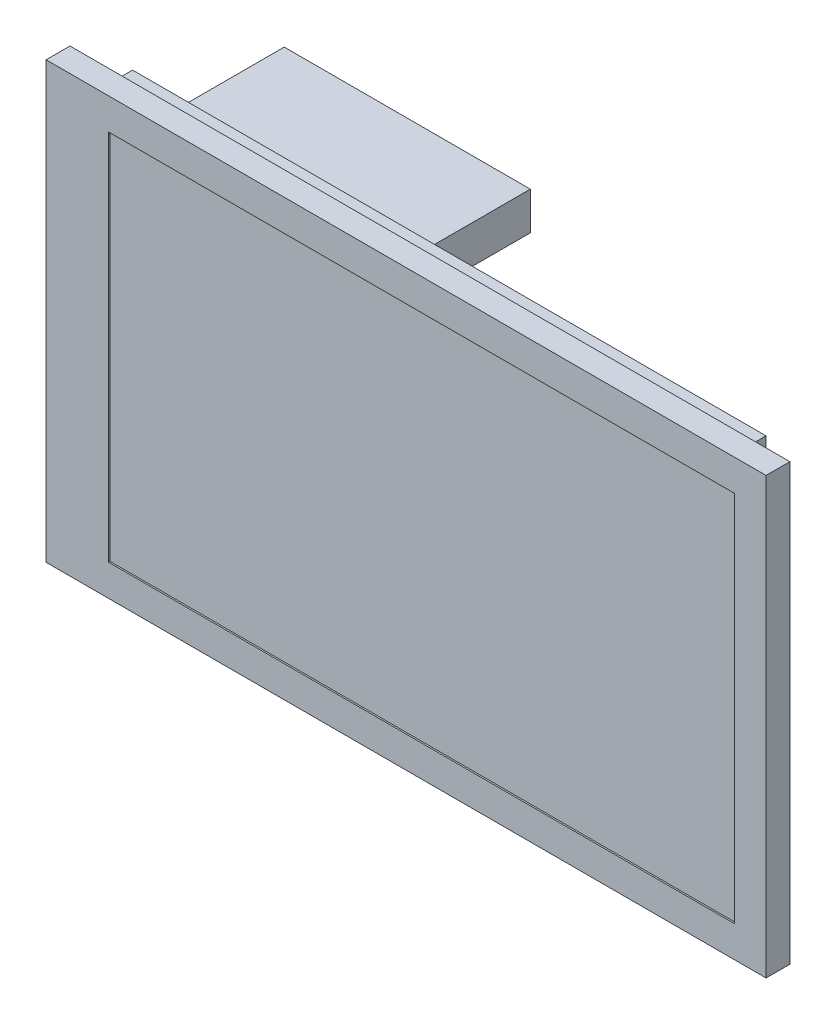
from build123d import *

# Parameters (mm, degrees)
SKETCH1_W                = 84
SKETCH1_H                = 50
BOSS_EXTRUDE1_DEPTH      = 3
BOSS_EXTRUDE2_DEPTH      = 0.2
BOSS_EXTRUDE2_DEPTH_BACK = 3
SKETCH2_W                = 96.6
SKETCH2_H                = 58.4
SKETCH2_W_2              = 84
SKETCH2_H_2              = 50
SKETCH4_W                = 84.6
SKETCH4_H                = 46.4
BOSS_EXTRUDE4_DEPTH      = 1
SKETCH5_W                = 85
SKETCH5_H                = 56
BOSS_EXTRUDE5_DEPTH      = 1.6
SKETCH6_W                = 2.54
SKETCH6_H                = 2.54
SKETCH6_W_2              = 1.3
SKETCH6_H_2              = 1.3
BOSS_EXTRUDE6_DEPTH      = 13.65
LPATTERN1_COUNT          = 13
LPATTERN1_PITCH          = 2.54
LPATTERN1_COUNT_DIR2     = 2
LPATTERN1_PITCH_DIR2     = 2.54
SKETCH7_W                = 10.2
SKETCH7_H                = 4.7
SKETCH7_W_2              = 5.3
SKETCH7_H_2              = 5.6
SKETCH7_W_3              = 3.5
SKETCH7_H_3              = 1.7
SKETCH7_W_4              = 3.7
SKETCH7_H_4              = 6.2
BOSS_EXTRUDE7_DEPTH      = 1.7
SKETCH8_W                = 0.528571429
SKETCH8_H                = 0.384415585
SKETCH8_H_2              = 0.384415584
SKETCH8_W_2              = 2.690909091
BOSS_EXTRUDE8_DEPTH      = 0.1


with BuildPart() as part:
    # Sketch1 → Boss-Extrude1 (new body)
    with BuildSketch(Plane.XY):
        Rectangle(SKETCH1_W, SKETCH1_H)
    extrude(amount=-BOSS_EXTRUDE1_DEPTH)

    # Sketch2 → Boss-Extrude2 (add, two sides: drawn at the far end of the back side and taken through both)
    with BuildSketch(Plane.XY.offset(-BOSS_EXTRUDE2_DEPTH_BACK)):
        with Locations((-2.1, 0)):
            Rectangle(SKETCH2_W, SKETCH2_H)
        Rectangle(SKETCH2_W_2, SKETCH2_H_2, mode=Mode.SUBTRACT)
    extrude(amount=BOSS_EXTRUDE2_DEPTH + BOSS_EXTRUDE2_DEPTH_BACK)

    # Sketch4 → Boss-Extrude4 (add)
    with BuildSketch(Plane(origin=(0, 0, -3), x_dir=(-1, 0, 0), z_dir=(0, 0, -1))):
        with Locations((2.1, 0)):
            Rectangle(SKETCH4_W, SKETCH4_H)
    extrude(amount=BOSS_EXTRUDE4_DEPTH)

    # Sketch5 → Boss-Extrude5 (add)
    with BuildSketch(Plane(origin=(0, 0, -4), x_dir=(-1, 0, 0), z_dir=(0, 0, -1))):
        with Locations((2.1, 0)):
            Rectangle(SKETCH5_W, SKETCH5_H)
    extrude(amount=BOSS_EXTRUDE5_DEPTH)

    # Sketch6 → Boss-Extrude6 (add)
    with BuildSketch(Plane(origin=(0, 0, -5.6), x_dir=(-1, 0, 0), z_dir=(0, 0, -1))):
        with Locations((36.63, 25.93)):
            Rectangle(SKETCH6_W, SKETCH6_H)
        with Locations((36.63, 25.93)):
            Rectangle(SKETCH6_W_2, SKETCH6_H_2, mode=Mode.SUBTRACT)
    boss_extrude6 = extrude(amount=BOSS_EXTRUDE6_DEPTH)

    # LPattern1: Boss-Extrude6 13 × 2
    with Locations(*[(i * LPATTERN1_PITCH, -j * LPATTERN1_PITCH_DIR2, 0) for i in range(LPATTERN1_COUNT) for j in range(LPATTERN1_COUNT_DIR2) if (i, j) != (0, 0)]):
        add(boss_extrude6)

    # Sketch7 → Boss-Extrude7 (add)
    with BuildSketch(Plane(origin=(0, 0, -5.6), x_dir=(-1, 0, 0), z_dir=(0, 0, -1))):
        with Locations((8.1, -10.35)):
            Rectangle(SKETCH7_W, SKETCH7_H)
        with Locations((8.1, -0.55)):
            Rectangle(SKETCH7_W, SKETCH7_H)
        with Locations((8.1, 12.65)):
            Rectangle(SKETCH7_W, SKETCH7_H)
        with Locations((-4.3, 12.65)):
            Rectangle(SKETCH7_W, SKETCH7_H)
        with Locations((26.95, 0.7)):
            Rectangle(SKETCH7_W_2, SKETCH7_H_2)
        with Locations((36.35, 6.15)):
            Rectangle(SKETCH7_W_3, SKETCH7_H_3)
        with Locations((36.45, 1.1)):
            Rectangle(SKETCH7_W_4, SKETCH7_H_4)
        with Locations((36.35, -4.35)):
            Rectangle(SKETCH7_W_3, SKETCH7_H_3)
    extrude(amount=BOSS_EXTRUDE7_DEPTH)

    # Sketch8 → Boss-Extrude8 (add)
    # profile 1 of 18: a face of its own
    with BuildSketch(Plane(origin=(0, 0, -5.6), x_dir=(-1, 0, 0), z_dir=(0, 0, -1))):
        with BuildLine():
            Line((-33.709090909, -24.401219239), (-33.757142857, -24.016803654))
            add(Edge.make_bspline(
                [(-33.757142857, -24.016803654), (-33.72805265, -24.011845745), (-33.671366483, -24.002184595), (-33.589792673, -23.983175734), (-33.51346079, -23.962429355), (-33.44308942, -23.938383841), (-33.377991194, -23.91217353), (-33.318581194, -23.883108061), (-33.264869364, -23.850611793), (-33.216824573, -23.815484607), (-33.174219303, -23.777618003), (-33.137332634, -23.737184237), (-33.106190952, -23.693804629), (-33.080274432, -23.647892699), (-33.061048466, -23.598721901), (-33.04637523, -23.547258356), (-33.038214219, -23.4927459), (-33.03698946, -23.455472208), (-33.036363636, -23.436426219)],
                knots=[0, 0, 0, 0, 1.392235382, 2.712957193, 3.95076201, 5.123471921, 6.220028287, 7.260520794, 8.240826993, 9.178593426, 10.065213643, 10.926376853, 11.755607984, 12.580369742, 13.407158359, 14.241002189, 15.101193065, 16, 16, 16, 16], degree=3))
            add(Edge.make_bspline(
                [(-33.036363636, -23.436426219), (-33.036759999, -23.415594785), (-33.037539057, -23.374650247), (-33.049145033, -23.314648819), (-33.06498982, -23.256354123), (-33.089668669, -23.200771333), (-33.119992727, -23.146921758), (-33.156578054, -23.094737727), (-33.201806698, -23.046270859), (-33.251523641, -22.999070538), (-33.306721122, -22.955548008), (-33.366993183, -22.917980414), (-33.431320052, -22.886597619), (-33.499064455, -22.859559114), (-33.571679862, -22.841042414), (-33.647435373, -22.825219515), (-33.727699215, -22.817413688), (-33.782407808, -22.816151783), (-33.810450487, -22.815504953)],
                knots=[0, 0, 0, 0, 0.90401877, 1.776864238, 2.648081008, 3.525187418, 4.41175602, 5.332444618, 6.287459433, 7.287987893, 8.31086095, 9.337199425, 10.368656826, 11.419214808, 12.501240718, 13.621372252, 14.780756564, 16, 16, 16, 16], degree=3))
            add(Edge.make_bspline(
                [(-33.810450487, -22.815504953), (-33.83674454, -22.816185809), (-33.88793822, -22.817511415), (-33.962820531, -22.824802446), (-34.033764203, -22.838161351), (-34.100575379, -22.858121567), (-34.164283462, -22.881758082), (-34.223586775, -22.911928591), (-34.278828269, -22.947530169), (-34.329602926, -22.987812879), (-34.375399178, -23.03226819), (-34.416031533, -23.079218976), (-34.450189652, -23.129025747), (-34.477354958, -23.181677852), (-34.499230924, -23.236433178), (-34.515191196, -23.293771003), (-34.524299668, -23.353792737), (-34.525408672, -23.394600357), (-34.525974026, -23.415403492)],
                knots=[0, 0, 0, 0, 1.208597586, 2.353100882, 3.45394355, 4.52041929, 5.55433039, 6.572835576, 7.571467818, 8.570232532, 9.546354476, 10.500752408, 11.419554319, 12.314725937, 13.218209175, 14.125127028, 15.044216874, 16, 16, 16, 16], degree=3))
            add(Edge.make_bspline(
                [(-34.525974026, -23.415403492), (-34.52538209, -23.43421221), (-34.524120244, -23.474307222), (-34.513207698, -23.537442526), (-34.497870236, -23.607313608), (-34.482819757, -23.655266555), (-34.474918831, -23.680440018)],
                knots=[0, 0, 0, 0, 0.832645691, 1.774971563, 2.831945141, 4, 4, 4, 4], degree=3))
            Line((-34.474918831, -23.680440018), (-34.91038961, -23.63238807))
            Line((-34.91038961, -23.63238807), (-34.905133929, -23.57457557))
            add(Edge.make_bspline(
                [(-34.905133929, -23.57457557), (-34.905389127, -23.552266942), (-34.905887105, -23.508735268), (-34.914980269, -23.445052273), (-34.927178755, -23.384368767), (-34.945160313, -23.326904528), (-34.969133857, -23.273255413), (-34.996255312, -23.221673826), (-35.030830796, -23.174607452), (-35.068634756, -23.13000737), (-35.111751787, -23.090663828), (-35.157304231, -23.054672672), (-35.207380206, -23.025663158), (-35.260533703, -23.001048649), (-35.317363124, -22.982837619), (-35.377308583, -22.968808647), (-35.440794476, -22.961712637), (-35.484245896, -22.960356448), (-35.506534091, -22.959660797)],
                knots=[0, 0, 0, 0, 1.104751502, 2.155743671, 3.182513959, 4.171256571, 5.132373004, 6.092768569, 7.053244257, 8.020744794, 8.986334532, 9.941668794, 10.892724274, 11.847575109, 12.840124028, 13.845307576, 14.89476101, 16, 16, 16, 16], degree=3))
            add(Edge.make_bspline(
                [(-35.506534091, -22.959660797), (-35.546468143, -22.961371554), (-35.623214248, -22.964659323), (-35.732652217, -22.990290916), (-35.829854701, -23.034168014), (-35.912619476, -23.095435068), (-35.979485312, -23.168511938), (-36.028391335, -23.250949201), (-36.058188146, -23.34158199), (-36.061797949, -23.40492), (-36.063636364, -23.437177031)],
                knots=[0, 0, 0, 0, 1.16832052, 2.245303051, 3.268291818, 4.269210926, 5.239185917, 6.148985104, 7.05730787, 8, 8, 8, 8], degree=3))
            add(Edge.make_bspline(
                [(-36.063636364, -23.437177031), (-36.062074934, -23.470681699), (-36.059037413, -23.535859893), (-36.03017405, -23.629106377), (-35.985773103, -23.714570317), (-35.933243599, -23.777451186), (-35.882808638, -23.821875076), (-35.839717993, -23.852650786), (-35.792409841, -23.880704007), (-35.73993312, -23.90419119), (-35.683769052, -23.926859716), (-35.621941335, -23.942876542), (-35.556351546, -23.958880175), (-35.51061513, -23.965391537), (-35.487012987, -23.968751706)],
                knots=[0, 0, 0, 0, 1.388978158, 2.702043981, 4.01873002, 5.370445164, 6.077879322, 6.808188353, 7.568116439, 8.359222831, 9.195597867, 10.081410868, 11.009917745, 12, 12, 12, 12], degree=3))
            Line((-35.487012987, -23.968751706), (-35.535064935, -24.353167291))
            add(Edge.make_bspline(
                [(-35.535064935, -24.353167291), (-35.571697972, -24.346872738), (-35.643158088, -24.334593947), (-35.745985257, -24.30894068), (-35.842047071, -24.278409893), (-35.930814562, -24.241444431), (-36.013058354, -24.199471816), (-36.088431365, -24.151983703), (-36.157428445, -24.099598625), (-36.218143885, -24.040496654), (-36.27222007, -23.977681211), (-36.318921262, -23.911115814), (-36.359118515, -23.841987277), (-36.391502117, -23.769156198), (-36.417180802, -23.69330645), (-36.435150549, -23.614058254), (-36.445773653, -23.531818803), (-36.447285252, -23.476000117), (-36.448051948, -23.447688394)],
                knots=[0, 0, 0, 0, 1.259750421, 2.457396855, 3.589696629, 4.673763457, 5.713494597, 6.716289503, 7.690389722, 8.644478697, 9.583164327, 10.496506905, 11.397350125, 12.289843847, 13.194037124, 14.107891875, 15.040306322, 16, 16, 16, 16], degree=3))
            add(Edge.make_bspline(
                [(-36.448051948, -23.447688394), (-36.447173676, -23.417856142), (-36.445445809, -23.359165736), (-36.432138518, -23.272918699), (-36.411523743, -23.189912141), (-36.381049885, -23.110760183), (-36.342532889, -23.034860215), (-36.294735039, -22.962711808), (-36.239073258, -22.893464082), (-36.175572177, -22.828463974), (-36.105313345, -22.769491941), (-36.029874393, -22.717518049), (-35.950287212, -22.672671219), (-35.865349964, -22.637609175), (-35.776405977, -22.609703357), (-35.683213519, -22.589499218), (-35.585455626, -22.577093922), (-35.518834964, -22.575870801), (-35.484760552, -22.575245213)],
                knots=[0, 0, 0, 0, 0.987388499, 1.942536239, 2.883158237, 3.814277833, 4.744511983, 5.696058098, 6.674468722, 7.682403848, 8.699933891, 9.706744222, 10.712052869, 11.718590333, 12.743383256, 13.79503062, 14.872226231, 16, 16, 16, 16], degree=3))
            add(Edge.make_bspline(
                [(-35.484760552, -22.575245213), (-35.443617466, -22.57640178), (-35.363265624, -22.578660538), (-35.246708501, -22.600432601), (-35.137357998, -22.634984802), (-35.035941462, -22.683176598), (-34.942979926, -22.743229189), (-34.860750059, -22.815359853), (-34.787862119, -22.897680072), (-34.749570843, -22.960272743), (-34.730194805, -22.9919457)],
                knots=[0, 0, 0, 0, 1.090109576, 2.128968013, 3.132278696, 4.123864162, 5.09769889, 6.057339906, 7.016980922, 8, 8, 8, 8], degree=3))
            add(Edge.make_bspline(
                [(-34.730194805, -22.9919457), (-34.721242985, -22.962852021), (-34.703752266, -22.906006665), (-34.664364047, -22.827584208), (-34.618622091, -22.756076299), (-34.56375654, -22.69218268), (-34.499748822, -22.6353556), (-34.426154491, -22.584612702), (-34.342270179, -22.541015349), (-34.250186626, -22.501627356), (-34.149969411, -22.47076018), (-34.043622195, -22.447045156), (-33.931177043, -22.433597248), (-33.854282585, -22.431937988), (-33.814955357, -22.431089369)],
                knots=[0, 0, 0, 0, 0.945190562, 1.846782401, 2.71900073, 3.580139159, 4.456653473, 5.37426406, 6.352713278, 7.392141409, 8.485180558, 9.608884637, 10.777077804, 12, 12, 12, 12], degree=3))
            add(Edge.make_bspline(
                [(-33.814955357, -22.431089369), (-33.773114973, -22.431834475), (-33.691429591, -22.433289153), (-33.571909415, -22.448168852), (-33.458142952, -22.471337505), (-33.349727003, -22.503117297), (-33.24768961, -22.545899123), (-33.150983091, -22.596751434), (-33.060656885, -22.658042225), (-32.976907169, -22.727702576), (-32.901228277, -22.803525995), (-32.833967865, -22.883369618), (-32.778874842, -22.968198019), (-32.731175696, -23.05516763), (-32.696165512, -23.147054318), (-32.670289121, -23.24204549), (-32.655079715, -23.341085707), (-32.653001381, -23.408344818), (-32.651948052, -23.442432713)],
                knots=[0, 0, 0, 0, 1.16811134, 2.280514916, 3.358044357, 4.408548324, 5.43018962, 6.443354211, 7.455384821, 8.473000684, 9.481330986, 10.444351977, 11.382702375, 12.302115503, 13.209492159, 14.121756026, 15.048078649, 16, 16, 16, 16], degree=3))
            add(Edge.make_bspline(
                [(-32.651948052, -23.442432713), (-32.65278928, -23.474014527), (-32.654446319, -23.536223946), (-32.66829631, -23.627607931), (-32.691048867, -23.715018976), (-32.721581309, -23.79923115), (-32.762884655, -23.879188949), (-32.812301875, -23.955742921), (-32.870988171, -24.028626606), (-32.937990742, -24.097174862), (-33.013039861, -24.1597859), (-33.093919003, -24.216704946), (-33.180964083, -24.266410952), (-33.275047043, -24.307663151), (-33.374834515, -24.341923846), (-33.480628851, -24.369978799), (-33.59261456, -24.390345858), (-33.669726101, -24.397544428), (-33.709090909, -24.401219239)],
                knots=[0, 0, 0, 0, 0.959215385, 1.889449177, 2.800558469, 3.700364268, 4.604976927, 5.528817283, 6.464628809, 7.443299003, 8.436397546, 9.430019983, 10.444889234, 11.476401659, 12.54654308, 13.647683262, 14.799161616, 16, 16, 16, 16], degree=3))
        make_face()
    # profile 2 of 18: a face of its own
    with BuildSketch(Plane(origin=(0, 0, -5.6), x_dir=(-1, 0, 0), z_dir=(0, 0, -1))):
        with Locations((-32.964285715, -21.6622582)):
            Rectangle(SKETCH8_W, SKETCH8_H)
    # profile 3 of 18: a face of its own
    with BuildSketch(Plane(origin=(0, 0, -5.6), x_dir=(-1, 0, 0), z_dir=(0, 0, -1))):
        with BuildLine():
            Line((-33.709090909, -20.845375083), (-33.757142857, -20.460959498))
            add(Edge.make_bspline(
                [(-33.757142857, -20.460959498), (-33.727801933, -20.457056848), (-33.670621561, -20.44945126), (-33.588302096, -20.432529035), (-33.511187899, -20.413811095), (-33.440920724, -20.389086983), (-33.375328546, -20.363412174), (-33.316364664, -20.332348308), (-33.262356892, -20.298850794), (-33.215239632, -20.260803413), (-33.172755898, -20.221350589), (-33.137031227, -20.178980534), (-33.10551633, -20.135927018), (-33.079965836, -20.090888865), (-33.060159869, -20.044039987), (-33.046807911, -19.995535552), (-33.038198069, -19.945706224), (-33.036978747, -19.911901138), (-33.036363636, -19.894847485)],
                knots=[0, 0, 0, 0, 1.411589299, 2.750942728, 4.00771248, 5.193274551, 6.301848483, 7.364530321, 8.36815806, 9.328452501, 10.249032995, 11.129646394, 11.967965374, 12.7913576, 13.594060915, 14.387835106, 15.186711129, 16, 16, 16, 16], degree=3))
            add(Edge.make_bspline(
                [(-33.036363636, -19.894847485), (-33.037067015, -19.873524117), (-33.038459015, -19.831324717), (-33.050140011, -19.769257186), (-33.069025063, -19.709514726), (-33.095405884, -19.651766971), (-33.130573043, -19.597153793), (-33.171999069, -19.543813508), (-33.222048681, -19.493965194), (-33.278207911, -19.445857991), (-33.340753879, -19.401367032), (-33.41054695, -19.364200444), (-33.485136496, -19.331884072), (-33.565025194, -19.304415786), (-33.650890473, -19.284573407), (-33.742020587, -19.270640191), (-33.838535134, -19.26119692), (-33.904778935, -19.260182419), (-33.938839286, -19.259660797)],
                knots=[0, 0, 0, 0, 0.833503236, 1.64952068, 2.460650161, 3.279715081, 4.124353123, 4.995793989, 5.916428404, 6.881576056, 7.886415737, 8.911413223, 9.967990459, 11.063833818, 12.210651719, 13.409634283, 14.668120429, 16, 16, 16, 16], degree=3))
            add(Edge.make_bspline(
                [(-33.938839286, -19.259660797), (-33.970643357, -19.26025579), (-34.032609553, -19.261415057), (-34.122888222, -19.269872427), (-34.207820421, -19.282931512), (-34.287286095, -19.302387222), (-34.360834439, -19.32831408), (-34.429726113, -19.357799952), (-34.492646202, -19.394217586), (-34.549273544, -19.436352956), (-34.600509338, -19.481690174), (-34.644378205, -19.531188087), (-34.681946452, -19.582915847), (-34.713671974, -19.637402035), (-34.736255635, -19.69567679), (-34.754281659, -19.75603236), (-34.763735167, -19.819723368), (-34.765390885, -19.86303708), (-34.766233766, -19.885086933)],
                knots=[0, 0, 0, 0, 1.312040837, 2.556345105, 3.737883698, 4.854849349, 5.925960309, 6.952388988, 7.9424386, 8.917239489, 9.860521384, 10.760061641, 11.639947922, 12.495504232, 13.352616949, 14.212152034, 15.089854369, 16, 16, 16, 16], degree=3))
            add(Edge.make_bspline(
                [(-34.766233766, -19.885086933), (-34.765094191, -19.911719603), (-34.762820853, -19.964849075), (-34.743864174, -20.043090359), (-34.713645505, -20.118748419), (-34.6714381, -20.190896214), (-34.618138106, -20.257469312), (-34.554874838, -20.31736285), (-34.482614089, -20.370476326), (-34.428781598, -20.398580713), (-34.401339286, -20.41290755)],
                knots=[0, 0, 0, 0, 0.943121662, 1.881431981, 2.836990949, 3.823036868, 4.833137184, 5.849762362, 6.903868453, 8, 8, 8, 8], degree=3))
            Line((-34.401339286, -20.41290755), (-34.456148539, -20.797323135))
            Line((-34.456148539, -20.797323135), (-36.351948052, -20.509011446))
            Line((-36.351948052, -20.509011446), (-36.351948052, -19.019401057))
            Line((-36.351948052, -19.019401057), (-35.919480519, -19.019401057))
            Line((-35.919480519, -19.019401057), (-35.919480519, -20.186913232))
            Line((-35.919480519, -20.186913232), (-35.005742695, -20.325813394))
            add(Edge.make_bspline(
                [(-35.005742695, -20.325813394), (-35.027889413, -20.282508043), (-35.071719564, -20.196803241), (-35.11736578, -20.06043535), (-35.145533845, -19.920291611), (-35.148938465, -19.825403774), (-35.150649351, -19.777720862)],
                knots=[0, 0, 0, 0, 1.017619267, 2.013951072, 3.001973272, 4, 4, 4, 4], degree=3))
            add(Edge.make_bspline(
                [(-35.150649351, -19.777720862), (-35.149596954, -19.747875438), (-35.147505352, -19.688558691), (-35.132050745, -19.601364271), (-35.107312005, -19.51703898), (-35.071421622, -19.435975975), (-35.025492672, -19.358132784), (-34.969882308, -19.28292689), (-34.904488116, -19.210722307), (-34.828658938, -19.143058026), (-34.745239346, -19.079989031), (-34.65364879, -19.024926282), (-34.555124606, -18.978194079), (-34.449195703, -18.941111803), (-34.336930721, -18.910565227), (-34.217279829, -18.889936055), (-34.090744903, -18.878075563), (-34.004185521, -18.876203711), (-33.959862013, -18.875245213)],
                knots=[0, 0, 0, 0, 0.861018809, 1.711245113, 2.547675859, 3.391805506, 4.262674834, 5.151129072, 6.086914488, 7.068866089, 8.080081396, 9.100796714, 10.1476286, 11.221399762, 12.335728169, 13.501851446, 14.720800604, 16, 16, 16, 16], degree=3))
            add(Edge.make_bspline(
                [(-33.959862013, -18.875245213), (-33.915786268, -18.876159756), (-33.828949865, -18.877961557), (-33.701160167, -18.89072167), (-33.578259095, -18.912669914), (-33.460241362, -18.942559842), (-33.346882808, -18.980912223), (-33.238352545, -19.028366147), (-33.134750653, -19.084840604), (-33.036667832, -19.148861328), (-32.947079052, -19.220172926), (-32.867881977, -19.29812462), (-32.800806159, -19.382172731), (-32.746090859, -19.472536113), (-32.703688244, -19.568695693), (-32.673722634, -19.670893893), (-32.655198057, -19.779050389), (-32.653046428, -19.853227234), (-32.651948052, -19.891093427)],
                knots=[0, 0, 0, 0, 1.144492614, 2.254837035, 3.330813134, 4.383755227, 5.413414698, 6.434919789, 7.455680344, 8.474121079, 9.472858394, 10.424138735, 11.353862604, 12.257787762, 13.159841921, 14.074912736, 15.017271142, 16, 16, 16, 16], degree=3))
            add(Edge.make_bspline(
                [(-32.651948052, -19.891093427), (-32.652881122, -19.922660977), (-32.654718012, -19.984806478), (-32.667241058, -20.076359656), (-32.690544318, -20.163517978), (-32.719974247, -20.247880921), (-32.760529929, -20.327475573), (-32.808664957, -20.403942271), (-32.866220567, -20.476276046), (-32.932214928, -20.544269908), (-33.005360277, -20.607195904), (-33.085841624, -20.663295295), (-33.173092542, -20.712086778), (-33.267404243, -20.753474312), (-33.368347828, -20.786937679), (-33.475731707, -20.814018055), (-33.589857358, -20.834598468), (-33.668721708, -20.841726417), (-33.709090909, -20.845375083)],
                knots=[0, 0, 0, 0, 0.958689857, 1.887326147, 2.797936266, 3.6946441, 4.595336751, 5.504073741, 6.434636212, 7.396724143, 8.377688541, 9.360182663, 10.370759081, 11.408658253, 12.482955239, 13.5963024, 14.769591684, 16, 16, 16, 16], degree=3))
        make_face()
    # profile 4 of 18: a face of its own
    with BuildSketch(Plane(origin=(0, 0, -5.6), x_dir=(-1, 0, 0), z_dir=(0, 0, -1))):
        with Locations((-36.135714286, -18.20251794)):
            Rectangle(SKETCH8_W, SKETCH8_H_2)
    # profile 5 of 18: a face of its own
    with BuildSketch(Plane(origin=(0, 0, -5.6), x_dir=(-1, 0, 0), z_dir=(0, 0, -1))):
        with Locations((-34.045454546, -18.20251794)):
            Rectangle(SKETCH8_W_2, SKETCH8_H_2)
    # profile 6 of 18: a face of its own
    with BuildSketch(Plane(origin=(0, 0, -5.6), x_dir=(-1, 0, 0), z_dir=(0, 0, -1))):
        with BuildLine():
            Line((-32.7, -17.433686771), (-35.390909091, -17.433686771))
            Line((-35.390909091, -17.433686771), (-35.390909091, -17.097323135))
            Line((-35.390909091, -17.097323135), (-35.006493506, -17.097323135))
            add(Edge.make_bspline(
                [(-35.006493506, -17.097323135), (-35.041046543, -17.076833356), (-35.107800216, -17.037248761), (-35.196887976, -16.966598701), (-35.271687706, -16.888899944), (-35.333457492, -16.804759272), (-35.381582035, -16.713819172), (-35.414239059, -16.615565035), (-35.435349553, -16.511337957), (-35.437741479, -16.439466892), (-35.438961039, -16.402822323)],
                knots=[0, 0, 0, 0, 1.116801742, 2.157570631, 3.152411596, 4.109288682, 5.053077691, 6.00219512, 6.981388438, 8, 8, 8, 8], degree=3))
            add(Edge.make_bspline(
                [(-35.438961039, -16.402822323), (-35.438061377, -16.373995355), (-35.436292135, -16.317305316), (-35.423291181, -16.233895457), (-35.401447954, -16.154129297), (-35.371342848, -16.078147936), (-35.334137479, -16.00754958), (-35.29134082, -15.943140458), (-35.242726387, -15.886439463), (-35.188971285, -15.835643416), (-35.126970352, -15.793038232), (-35.058288703, -15.754595732), (-34.980308474, -15.724876586), (-34.909850225, -15.703109756), (-34.847304858, -15.689553083), (-34.793379285, -15.680801262), (-34.73363418, -15.67213038), (-34.667652679, -15.666938146), (-34.596137345, -15.660992677), (-34.518471077, -15.658737459), (-34.434893337, -15.656075352), (-34.37706601, -15.655870306), (-34.347280844, -15.655764693)],
                knots=[0, 0, 0, 0, 1.141305252, 2.244448229, 3.333612062, 4.410258439, 5.474240107, 6.488548369, 7.465716174, 8.426461525, 9.408092337, 10.43715827, 11.535884822, 12.705414589, 13.354711796, 14.068366378, 14.868699478, 15.744456403, 16.688545682, 17.710139244, 18.820559672, 20, 20, 20, 20], degree=3))
            Line((-34.347280844, -15.655764693), (-32.7, -15.655764693))
            Line((-32.7, -15.655764693), (-32.7, -16.040180278))
            Line((-32.7, -16.040180278), (-34.335267857, -16.040180278))
            add(Edge.make_bspline(
                [(-34.335267857, -16.040180278), (-34.381328794, -16.040703329), (-34.467046597, -16.041676708), (-34.585807866, -16.049917557), (-34.684534984, -16.065290543), (-34.765780424, -16.085951834), (-34.832541735, -16.114694694), (-34.890050973, -16.149716174), (-34.939945837, -16.191816038), (-34.981457228, -16.24087005), (-35.013869304, -16.295306276), (-35.037434635, -16.3540219), (-35.052275924, -16.416855082), (-35.053780101, -16.460301847), (-35.054545455, -16.482408362)],
                knots=[0, 0, 0, 0, 1.730270716, 3.219973732, 4.467284425, 5.479848773, 6.360024925, 7.187189966, 8.000942814, 8.801445218, 9.589876679, 10.3702515, 11.170753904, 12, 12, 12, 12], degree=3))
            add(Edge.make_bspline(
                [(-35.054545455, -16.482408362), (-35.054087441, -16.503481859), (-35.053188002, -16.544865599), (-35.042629795, -16.604836985), (-35.02839626, -16.662263629), (-35.004947071, -16.715364078), (-34.97765393, -16.76640955), (-34.942330727, -16.813052442), (-34.901764693, -16.856776764), (-34.854508072, -16.897355103), (-34.799231564, -16.933311786), (-34.735448541, -16.965311929), (-34.662308268, -16.990761613), (-34.580840731, -17.012817162), (-34.490340033, -17.028792261), (-34.391080127, -17.040595241), (-34.282831811, -17.048318424), (-34.207643769, -17.04894547), (-34.168587662, -17.049271187)],
                knots=[0, 0, 0, 0, 0.848393823, 1.666059943, 2.449137717, 3.226737531, 3.998886429, 4.777728677, 5.577206082, 6.40008348, 7.281485422, 8.228944943, 9.269283513, 10.397437078, 11.628233436, 12.969661854, 14.425903833, 16, 16, 16, 16], degree=3))
            Line((-34.168587662, -17.049271187), (-32.7, -17.049271187))
            Line((-32.7, -17.049271187), (-32.7, -17.433686771))
        make_face()
    # profile 7 of 18: a face of its own
    with BuildSketch(Plane(origin=(0, 0, -5.6), x_dir=(-1, 0, 0), z_dir=(0, 0, -1))):
        with BuildLine():
            Line((-33.709090909, -13.685634823), (-33.661038961, -13.301219239))
            add(Edge.make_bspline(
                [(-33.661038961, -13.301219239), (-33.621153754, -13.306949922), (-33.543450734, -13.318114247), (-33.431135749, -13.343249292), (-33.326103782, -13.373554782), (-33.228436748, -13.410532825), (-33.138274083, -13.45359749), (-33.054252201, -13.500983953), (-32.978796805, -13.556602447), (-32.910499004, -13.617264563), (-32.849845404, -13.682515246), (-32.796536561, -13.751085117), (-32.752666514, -13.82353601), (-32.714816495, -13.89810676), (-32.687321681, -13.977061277), (-32.667321694, -14.058776642), (-32.653575084, -14.143671807), (-32.652496364, -14.201387358), (-32.651948052, -14.230724109)],
                knots=[0, 0, 0, 0, 1.278711625, 2.491143031, 3.650103035, 4.746401266, 5.801838678, 6.819772002, 7.80339652, 8.771270125, 9.715643021, 10.627751752, 11.522957769, 12.400540247, 13.277511181, 14.169644946, 15.069632555, 16, 16, 16, 16], degree=3))
            add(Edge.make_bspline(
                [(-32.651948052, -14.230724109), (-32.652877142, -14.266075263), (-32.654706412, -14.335677574), (-32.671568273, -14.437560523), (-32.699721801, -14.534385167), (-32.737886534, -14.627089351), (-32.78889839, -14.713911757), (-32.849348058, -14.797074868), (-32.922016873, -14.874038096), (-33.004733886, -14.946668549), (-33.098780508, -15.011658031), (-33.203169572, -15.069347919), (-33.318438242, -15.116940948), (-33.444152974, -15.155952064), (-33.580215364, -15.186593603), (-33.726797548, -15.207958959), (-33.883802031, -15.220741028), (-33.991871668, -15.222426397), (-34.047706981, -15.223297161)],
                knots=[0, 0, 0, 0, 0.881117801, 1.734818454, 2.566421751, 3.39172422, 4.227812349, 5.071691584, 5.950485262, 6.861726115, 7.812261201, 8.795550278, 9.830659435, 10.91637181, 12.074681013, 13.305134636, 14.607669521, 16, 16, 16, 16], degree=3))
            add(Edge.make_bspline(
                [(-34.047706981, -15.223297161), (-34.103788129, -15.222391702), (-34.212598432, -15.220634903), (-34.370695631, -15.208273538), (-34.517896142, -15.185692702), (-34.654252083, -15.155213603), (-34.779825427, -15.116389261), (-34.894584904, -15.06828764), (-34.998939186, -15.011459615), (-35.091508845, -14.944817395), (-35.173257592, -14.872075944), (-35.244745193, -14.794445708), (-35.304490396, -14.711106396), (-35.353632343, -14.622696366), (-35.392245549, -14.529277627), (-35.419072612, -14.43063182), (-35.436274268, -14.327432119), (-35.438056145, -14.256821754), (-35.438961039, -14.220963557)],
                knots=[0, 0, 0, 0, 1.394064774, 2.704805743, 3.938375906, 5.092954163, 6.175169427, 7.201207899, 8.181329773, 9.122223902, 10.029975504, 10.897502837, 11.740043167, 12.572718076, 13.406855877, 14.246059128, 15.109292852, 16, 16, 16, 16], degree=3))
            add(Edge.make_bspline(
                [(-35.438961039, -14.220963557), (-35.438111836, -14.193163086), (-35.436438848, -14.138394246), (-35.427047643, -14.057815785), (-35.409268799, -13.981124811), (-35.386391163, -13.907358927), (-35.354910903, -13.837674151), (-35.318607054, -13.770116358), (-35.273417265, -13.707323717), (-35.223554323, -13.64649082), (-35.16516428, -13.591464805), (-35.101435034, -13.539497745), (-35.029525522, -13.495067968), (-34.951656342, -13.454628305), (-34.8665962, -13.420843189), (-34.775377466, -13.390154744), (-34.677043121, -13.366538769), (-34.608889889, -13.355115025), (-34.574025974, -13.349271187)],
                knots=[0, 0, 0, 0, 0.98498665, 1.940491496, 2.867400032, 3.770127352, 4.671111954, 5.571747607, 6.481714722, 7.4067562, 8.353461597, 9.318418812, 10.314472851, 11.341332532, 12.422870144, 13.552597359, 14.748026561, 16, 16, 16, 16], degree=3))
            Line((-34.574025974, -13.349271187), (-34.525974026, -13.733686771))
            add(Edge.make_bspline(
                [(-34.525974026, -13.733686771), (-34.567784581, -13.742980095), (-34.646886279, -13.760562204), (-34.755622707, -13.800454892), (-34.848147037, -13.84973097), (-34.923351889, -13.909606604), (-34.982797201, -13.976914506), (-35.023951013, -14.052453695), (-35.050088265, -14.134169908), (-35.053044341, -14.191234835), (-35.054545455, -14.220212745)],
                knots=[0, 0, 0, 0, 1.30892923, 2.476372928, 3.53146965, 4.501039313, 5.401935292, 6.258483729, 7.115647674, 8, 8, 8, 8], degree=3))
            add(Edge.make_bspline(
                [(-35.054545455, -14.220212745), (-35.05386188, -14.242040543), (-35.052516689, -14.284995034), (-35.040693831, -14.348005206), (-35.022311448, -14.408243654), (-34.995145593, -14.465038016), (-34.962367275, -14.519886722), (-34.920127647, -14.570598159), (-34.872283631, -14.620138445), (-34.815210754, -14.664990055), (-34.75083537, -14.706741399), (-34.676789008, -14.741573387), (-34.59502915, -14.772977013), (-34.503555203, -14.795814563), (-34.404216149, -14.815952352), (-34.295741939, -14.82874352), (-34.178483038, -14.837182692), (-34.097277263, -14.838301874), (-34.055215097, -14.838881576)],
                knots=[0, 0, 0, 0, 0.795490615, 1.565430281, 2.330538608, 3.086057015, 3.856321299, 4.654687412, 5.487385418, 6.364149907, 7.296018043, 8.27995087, 9.343020311, 10.485543343, 11.713658387, 13.038393194, 14.465976156, 16, 16, 16, 16], degree=3))
            add(Edge.make_bspline(
                [(-34.055215097, -14.838881576), (-34.01191031, -14.838200092), (-33.928487427, -14.836887273), (-33.807883232, -14.82983782), (-33.696599798, -14.81627023), (-33.594444063, -14.797885101), (-33.501509073, -14.773964416), (-33.417763868, -14.744808356), (-33.34297533, -14.710647618), (-33.277713938, -14.670402113), (-33.22115652, -14.625883195), (-33.172309951, -14.578194504), (-33.129232218, -14.528813007), (-33.095482072, -14.474861786), (-33.068820312, -14.418166267), (-33.050177101, -14.358547165), (-33.038354277, -14.296010995), (-33.037036926, -14.253302794), (-33.036363636, -14.23147492)],
                knots=[0, 0, 0, 0, 1.565718265, 3.016219225, 4.365187243, 5.616329694, 6.766277306, 7.83079009, 8.818512549, 9.732537315, 10.595943752, 11.414973053, 12.198132775, 12.958701172, 13.707554466, 14.457281824, 15.211527128, 16, 16, 16, 16], degree=3))
            add(Edge.make_bspline(
                [(-33.036363636, -14.23147492), (-33.036651609, -14.214416408), (-33.037222665, -14.180589035), (-33.046212787, -14.130871388), (-33.058797693, -14.082840177), (-33.075894824, -14.036403149), (-33.099521542, -13.992722781), (-33.128475079, -13.951347613), (-33.161692122, -13.911241198), (-33.199840966, -13.872919837), (-33.243854738, -13.837420877), (-33.293523508, -13.804943884), (-33.349305393, -13.777055456), (-33.409928012, -13.750812835), (-33.476671881, -13.729541607), (-33.549220836, -13.711645679), (-33.627173312, -13.696627772), (-33.681268894, -13.689368404), (-33.709090909, -13.685634823)],
                knots=[0, 0, 0, 0, 0.854725736, 1.694938312, 2.526473112, 3.345107711, 4.170933967, 5.010395515, 5.875390798, 6.781083367, 7.718516182, 8.707676132, 9.7522729, 10.843817801, 12.019249111, 13.261849065, 14.591735729, 16, 16, 16, 16], degree=3))
        make_face()
    # profile 8 of 18: a face of its own
    with BuildSketch(Plane(origin=(0, 0, -5.6), x_dir=(-1, 0, 0), z_dir=(0, 0, -1))):
        with BuildLine():
            Line((-32.7, -12.964855602), (-36.4, -12.964855602))
            Line((-36.4, -12.964855602), (-36.4, -12.580440018))
            Line((-36.4, -12.580440018), (-35.077069805, -12.580440018))
            add(Edge.make_bspline(
                [(-35.077069805, -12.580440018), (-35.105809969, -12.558725454), (-35.161682611, -12.51651101), (-35.235888992, -12.445385623), (-35.298502144, -12.370019746), (-35.350600147, -12.29080411), (-35.389413755, -12.206511462), (-35.418736782, -12.118814968), (-35.435231102, -12.026204645), (-35.437703734, -11.96308403), (-35.438961039, -11.930987907)],
                knots=[0, 0, 0, 0, 1.115529506, 2.168657786, 3.176523762, 4.146685432, 5.097307861, 6.043967695, 7.005379594, 8, 8, 8, 8], degree=3))
            add(Edge.make_bspline(
                [(-35.438961039, -11.930987907), (-35.438234341, -11.902922242), (-35.436821019, -11.848338576), (-35.425987392, -11.76865772), (-35.408837734, -11.693469171), (-35.38518807, -11.622393368), (-35.352870914, -11.556542332), (-35.314929955, -11.494719701), (-35.268927638, -11.437858336), (-35.216488857, -11.384649369), (-35.15358043, -11.337136855), (-35.079214925, -11.296981894), (-34.993555886, -11.262459869), (-34.896693874, -11.234379843), (-34.788209282, -11.212528625), (-34.668158292, -11.198579756), (-34.536665523, -11.188172595), (-34.4451603, -11.187357372), (-34.397585227, -11.186933524)],
                knots=[0, 0, 0, 0, 0.918936283, 1.787198329, 2.628261467, 3.44216605, 4.23402106, 5.02553662, 5.812796688, 6.624221109, 7.466840479, 8.383983785, 9.384005558, 10.486291561, 11.682268669, 13.003934646, 14.442296275, 16, 16, 16, 16], degree=3))
            Line((-34.397585227, -11.186933524), (-32.7, -11.186933524))
            Line((-32.7, -11.186933524), (-32.7, -11.571349109))
            Line((-32.7, -11.571349109), (-34.402090097, -11.571349109))
            add(Edge.make_bspline(
                [(-34.402090097, -11.571349109), (-34.430137923, -11.571454309), (-34.484302935, -11.571657469), (-34.562408446, -11.578352806), (-34.634576082, -11.586388597), (-34.700364217, -11.600538466), (-34.760311356, -11.61647156), (-34.814284013, -11.636377869), (-34.861119582, -11.66181326), (-34.902741408, -11.689267185), (-34.938773448, -11.720658898), (-34.969276735, -11.755328105), (-34.996003204, -11.792024108), (-35.017101479, -11.83213561), (-35.034819871, -11.874368009), (-35.045357744, -11.920363352), (-35.053631436, -11.968481182), (-35.054235793, -12.001774164), (-35.054545455, -12.018832875)],
                knots=[0, 0, 0, 0, 1.497580373, 2.892076563, 4.185500246, 5.373247229, 6.482481593, 7.498006995, 8.436991536, 9.323193913, 10.157024237, 10.980826884, 11.785865632, 12.575436512, 13.39717544, 14.224009969, 15.090015417, 16, 16, 16, 16], degree=3))
            add(Edge.make_bspline(
                [(-35.054545455, -12.018832875), (-35.05397414, -12.037889357), (-35.052840058, -12.075717236), (-35.043630909, -12.131145046), (-35.028627831, -12.184712488), (-35.006402022, -12.235492635), (-34.979540771, -12.285079157), (-34.945195947, -12.33130661), (-34.905967157, -12.376242519), (-34.859966041, -12.418416237), (-34.806149509, -12.457596374), (-34.742218858, -12.489946957), (-34.669839379, -12.519016874), (-34.587451838, -12.540554918), (-34.496257383, -12.558915376), (-34.395574479, -12.570870563), (-34.285622249, -12.579753433), (-34.209152445, -12.580204941), (-34.169338474, -12.580440018)],
                knots=[0, 0, 0, 0, 0.774321057, 1.537058296, 2.277762361, 3.029907886, 3.785897217, 4.565348269, 5.365507915, 6.208015593, 7.097442594, 8.062237367, 9.112711579, 10.26295355, 11.518033273, 12.89232435, 14.381989977, 16, 16, 16, 16], degree=3))
            Line((-34.169338474, -12.580440018), (-32.7, -12.580440018))
            Line((-32.7, -12.580440018), (-32.7, -12.964855602))
        make_face()
    # profile 9 of 18: a face of its own
    with BuildSketch(Plane(origin=(0, 0, -5.6), x_dir=(-1, 0, 0), z_dir=(0, 0, -1))):
        with BuildLine():
            Line((-32.7, -9.360959498), (-36.4, -9.360959498))
            Line((-36.4, -9.360959498), (-36.4, -8.001990343))
            add(Edge.make_bspline(
                [(-36.4, -8.001990343), (-36.399805055, -7.967694752), (-36.399427719, -7.901312105), (-36.393897752, -7.80515502), (-36.385874492, -7.715715886), (-36.374682493, -7.633285624), (-36.360944206, -7.557885757), (-36.34247321, -7.489830217), (-36.322207795, -7.42817304), (-36.28874327, -7.355597601), (-36.235867245, -7.273434793), (-36.156893751, -7.184086354), (-36.05877127, -7.106123876), (-35.946150922, -7.036686763), (-35.819670804, -6.979679986), (-35.681746089, -6.939295148), (-35.534177562, -6.914916714), (-35.432549225, -6.911872377), (-35.380397727, -6.910310148)],
                knots=[0, 0, 0, 0, 0.957632509, 1.853596319, 2.688865688, 3.464800978, 4.176232129, 4.827248354, 5.432859936, 5.986426289, 7.054779681, 8.148885667, 9.301586196, 10.541074307, 11.836203864, 13.163061816, 14.544199576, 16, 16, 16, 16], degree=3))
            add(Edge.make_bspline(
                [(-35.380397727, -6.910310148), (-35.345839083, -6.911129754), (-35.278335247, -6.912730702), (-35.179382479, -6.922356523), (-35.085336497, -6.939335125), (-34.996671992, -6.964561163), (-34.912562698, -6.994859034), (-34.834152186, -7.033746386), (-34.760304277, -7.078673495), (-34.691635449, -7.130768381), (-34.628620569, -7.189450355), (-34.570901691, -7.254132559), (-34.520867976, -7.326286764), (-34.475521896, -7.403674866), (-34.436395799, -7.487637885), (-34.403367492, -7.577764231), (-34.377244221, -7.674371099), (-34.364373432, -7.741116344), (-34.357792208, -7.775245213)],
                knots=[0, 0, 0, 0, 1.121876415, 2.19137531, 3.223949102, 4.219388443, 5.180726412, 6.121767895, 7.055309798, 7.98310721, 8.914383918, 9.846793912, 10.791230962, 11.759648879, 12.755485972, 13.793860249, 14.871933835, 16, 16, 16, 16], degree=3))
            add(Edge.make_bspline(
                [(-34.357792208, -7.775245213), (-34.343928842, -7.74997131), (-34.317471965, -7.70173854), (-34.273504072, -7.636839779), (-34.231382806, -7.579965817), (-34.199987023, -7.548431173), (-34.185105519, -7.533483849)],
                knots=[0, 0, 0, 0, 1.159024517, 2.21188481, 3.152438931, 4, 4, 4, 4], degree=3))
            add(Edge.make_bspline(
                [(-34.185105519, -7.533483849), (-34.148914998, -7.503500985), (-34.076126995, -7.4431981), (-33.960002863, -7.360532441), (-33.839201284, -7.281349629), (-33.7542236, -7.234849755), (-33.711343344, -7.211385635)],
                knots=[0, 0, 0, 0, 0.982253192, 1.975551771, 2.978451105, 4, 4, 4, 4], degree=3))
            Line((-33.711343344, -7.211385635), (-32.7, -6.670050407))
            Line((-32.7, -6.670050407), (-32.7, -7.10702281))
            Line((-32.7, -7.10702281), (-33.491355519, -7.534234661))
            add(Edge.make_bspline(
                [(-33.491355519, -7.534234661), (-33.528461086, -7.554136187), (-33.599435177, -7.592203055), (-33.700208741, -7.648697271), (-33.791088715, -7.701215954), (-33.872176039, -7.749656032), (-33.942571801, -7.794780782), (-34.003362474, -7.835207406), (-34.053652872, -7.872651681), (-34.10625904, -7.916199226), (-34.159208377, -7.968696604), (-34.213307891, -8.029663165), (-34.255112199, -8.090993363), (-34.286999489, -8.153365373), (-34.307994387, -8.222041879), (-34.323712931, -8.299421525), (-34.332261711, -8.388971921), (-34.333243503, -8.452460786), (-34.333766234, -8.486263881)],
                knots=[0, 0, 0, 0, 1.483604313, 2.837780862, 4.070509745, 5.182094193, 6.165504003, 7.016659521, 7.753887315, 8.373758725, 9.421416007, 10.377927395, 11.24132908, 12.030078718, 12.836042303, 13.763032878, 14.808981517, 16, 16, 16, 16], degree=3))
            Line((-34.333766234, -8.486263881), (-34.333766234, -8.976543914))
            Line((-34.333766234, -8.976543914), (-32.7, -8.976543914))
            Line((-32.7, -8.976543914), (-32.7, -9.360959498))
        make_face()
        with BuildLine():
            Line((-34.766233766, -8.976543914), (-34.766233766, -8.074819076))
            add(Edge.make_bspline(
                [(-34.766233766, -8.074819076), (-34.767136139, -8.028494898), (-34.768827275, -7.941678869), (-34.780059482, -7.82022381), (-34.800384057, -7.716556696), (-34.829990071, -7.62874845), (-34.869205944, -7.553856088), (-34.9178137, -7.488713071), (-34.975844536, -7.431205622), (-35.043449183, -7.383324556), (-35.117741407, -7.342403221), (-35.199795927, -7.315540376), (-35.286971695, -7.297059248), (-35.347259246, -7.295516236), (-35.378145292, -7.294725732)],
                knots=[0, 0, 0, 0, 1.473137061, 2.760802605, 3.873686451, 4.825077919, 5.697275026, 6.550455577, 7.400251438, 8.283812568, 9.177530931, 10.086115457, 11.019493646, 12, 12, 12, 12], degree=3))
            add(Edge.make_bspline(
                [(-35.378145292, -7.294725732), (-35.400436762, -7.295409771), (-35.443894568, -7.296743322), (-35.507577979, -7.304028086), (-35.567454545, -7.317466485), (-35.623737675, -7.336535072), (-35.676312045, -7.360269924), (-35.725198887, -7.390066427), (-35.769935383, -7.425475706), (-35.811631785, -7.465311536), (-35.848931447, -7.510642414), (-35.880029796, -7.562110167), (-35.907322646, -7.618097573), (-35.930037736, -7.67936521), (-35.946993995, -7.746097025), (-35.958709871, -7.817963169), (-35.966563989, -7.894700547), (-35.967203043, -7.947660774), (-35.967532468, -7.974961122)],
                knots=[0, 0, 0, 0, 1.044922679, 2.037104192, 2.998871072, 3.914999749, 4.817741419, 5.696780486, 6.590716951, 7.486574954, 8.395164589, 9.332593663, 10.297787276, 11.310892337, 12.389055078, 13.518989792, 14.721069654, 16, 16, 16, 16], degree=3))
            Line((-35.967532468, -7.974961122), (-35.967532468, -8.976543914))
            Line((-35.967532468, -8.976543914), (-34.766233766, -8.976543914))
        make_face(mode=Mode.SUBTRACT)
    # profile 10 of 18: a face of its own
    with BuildSketch(Plane(origin=(0, 0, -5.6), x_dir=(-1, 0, 0), z_dir=(0, 0, -1))):
        with BuildLine():
            Line((-32.7, -6.285634823), (-36.4, -6.285634823))
            Line((-36.4, -6.285634823), (-36.4, -5.14590268))
            add(Edge.make_bspline(
                [(-36.4, -5.14590268), (-36.400030536, -5.113360616), (-36.400089284, -5.050754549), (-36.39565745, -4.960169211), (-36.391179196, -4.875951048), (-36.382538132, -4.798395476), (-36.373102404, -4.727443818), (-36.361311324, -4.663168538), (-36.346409399, -4.605556802), (-36.334370231, -4.56972043), (-36.32867289, -4.552761446)],
                knots=[0, 0, 0, 0, 1.301145482, 2.503209419, 3.626350361, 4.67304202, 5.622796861, 6.488461115, 7.284688674, 8, 8, 8, 8], degree=3))
            add(Edge.make_bspline(
                [(-36.32867289, -4.552761446), (-36.320361164, -4.531287), (-36.303757408, -4.488388996), (-36.270977516, -4.427965536), (-36.234050337, -4.370322378), (-36.192001405, -4.316128717), (-36.144229571, -4.265642071), (-36.091754031, -4.218437758), (-36.034067593, -4.174398563), (-35.971156061, -4.134247065), (-35.904080331, -4.097507283), (-35.832710675, -4.065818781), (-35.757758098, -4.038682644), (-35.678787658, -4.017351059), (-35.596418084, -3.999570907), (-35.510283016, -3.988201814), (-35.420344872, -3.980112135), (-35.359144275, -3.979469842), (-35.327840909, -3.979141317)],
                knots=[0, 0, 0, 0, 0.897100314, 1.792074795, 2.674564512, 3.564737307, 4.462262183, 5.381335128, 6.314343954, 7.288893199, 8.288957636, 9.293725154, 10.330954979, 11.394032234, 12.481204951, 13.61431922, 14.779753114, 16, 16, 16, 16], degree=3))
            add(Edge.make_bspline(
                [(-35.327840909, -3.979141317), (-35.286766984, -3.979776889), (-35.20643602, -3.981019921), (-35.088942177, -3.993224575), (-34.977541323, -4.013508318), (-34.871698284, -4.041183323), (-34.771572901, -4.077125865), (-34.677428285, -4.121632795), (-34.588927278, -4.173844655), (-34.505904745, -4.233452007), (-34.430334212, -4.303693552), (-34.365684174, -4.3865923), (-34.310391413, -4.480384884), (-34.266442317, -4.586242163), (-34.230943329, -4.703084326), (-34.206743182, -4.831970655), (-34.192726814, -4.972403155), (-34.190675823, -5.069786882), (-34.18961039, -5.120375083)],
                knots=[0, 0, 0, 0, 1.066125632, 2.085091685, 3.062630143, 4.003547869, 4.922307223, 5.820454748, 6.703048758, 7.586837887, 8.469431897, 9.371589709, 10.306565591, 11.287746888, 12.340181319, 13.471797101, 14.68666727, 16, 16, 16, 16], degree=3))
            Line((-34.18961039, -5.120375083), (-34.18961039, -5.901219239))
            Line((-34.18961039, -5.901219239), (-32.7, -5.901219239))
            Line((-32.7, -5.901219239), (-32.7, -6.285634823))
        make_face()
        with BuildLine():
            Line((-34.622077922, -5.901219239), (-34.622077922, -5.096349109))
            add(Edge.make_bspline(
                [(-34.622077922, -5.096349109), (-34.622764287, -5.065804786), (-34.624094127, -5.006624835), (-34.631184104, -4.920726269), (-34.644715747, -4.841164076), (-34.663217601, -4.767942401), (-34.687440531, -4.701338286), (-34.716302818, -4.640644341), (-34.752199675, -4.587224085), (-34.792067085, -4.539192175), (-34.837869002, -4.497410091), (-34.889029878, -4.461264606), (-34.945979627, -4.431233894), (-35.007912638, -4.406484908), (-35.074986764, -4.386808353), (-35.147729095, -4.373669939), (-35.225785942, -4.365303793), (-35.279766306, -4.364150768), (-35.307568994, -4.363556901)],
                knots=[0, 0, 0, 0, 1.269558371, 2.459782834, 3.578031673, 4.619861022, 5.593750804, 6.519406645, 7.404988159, 8.261257356, 9.107807096, 9.973499244, 10.857552575, 11.776876264, 12.741222528, 13.757082215, 14.844781005, 16, 16, 16, 16], degree=3))
            add(Edge.make_bspline(
                [(-35.307568994, -4.363556901), (-35.34368821, -4.364383722), (-35.413333822, -4.365978011), (-35.513779765, -4.383382567), (-35.606608124, -4.409426896), (-35.689885984, -4.448302662), (-35.762688816, -4.493561268), (-35.825150195, -4.543039577), (-35.873687244, -4.598750084), (-35.905685087, -4.649509437), (-35.923567886, -4.695381614), (-35.935447076, -4.735571001), (-35.946193532, -4.781869914), (-35.952734136, -4.834763127), (-35.960125897, -4.893227188), (-35.964027099, -4.957912609), (-35.967404178, -5.028740111), (-35.967488433, -5.078073946), (-35.967532468, -5.103857226)],
                knots=[0, 0, 0, 0, 1.500146455, 2.892604724, 4.22616096, 5.497238847, 6.698375043, 7.785577188, 8.795758489, 9.757624722, 10.261937711, 10.838005889, 11.499383255, 12.235155917, 13.052161805, 13.949201158, 14.928193621, 16, 16, 16, 16], degree=3))
            Line((-35.967532468, -5.103857226), (-35.967532468, -5.901219239))
            Line((-35.967532468, -5.901219239), (-34.622077922, -5.901219239))
        make_face(mode=Mode.SUBTRACT)
    # profile 11 of 18: a face of its own
    with BuildSketch(Plane(origin=(0, 0, -5.6), x_dir=(-1, 0, 0), z_dir=(0, 0, -1))):
        with Locations((-36.135714286, -3.306414044)):
            Rectangle(SKETCH8_W, SKETCH8_H_2)
    # profile 12 of 18: a face of its own
    with BuildSketch(Plane(origin=(0, 0, -5.6), x_dir=(-1, 0, 0), z_dir=(0, 0, -1))):
        with Locations((-34.045454546, -3.306414044)):
            Rectangle(SKETCH8_W_2, SKETCH8_H_2)
    # profile 13 of 18: a face of its own
    with BuildSketch(Plane(origin=(0, 0, -5.6), x_dir=(-1, 0, 0), z_dir=(0, 0, -1))):
        Polygon((-32.7, -1.288232226), (-36.4, -1.288232226), (-36.4, -0.903816641), (-33.132467532, -0.903816641), (-33.132467532, 0.633845696), (-32.7, 0.633845696), align=None)
    # profile 14 of 18: a face of its own
    with BuildSketch(Plane(origin=(0, 0, -5.6), x_dir=(-1, 0, 0), z_dir=(0, 0, -1))):
        with BuildLine():
            Line((-33.997402597, 3.228650891), (-33.901298701, 3.613066476))
            add(Edge.make_bspline(
                [(-33.901298701, 3.613066476), (-33.850356386, 3.601609203), (-33.751040125, 3.579272301), (-33.608194113, 3.537370408), (-33.475610043, 3.488426506), (-33.352839743, 3.433697568), (-33.239861131, 3.373135711), (-33.137201329, 3.305962299), (-33.043987454, 3.233106643), (-32.96170284, 3.153216758), (-32.888056201, 3.068926978), (-32.825164464, 2.97932391), (-32.771030739, 2.885586044), (-32.72773515, 2.787021843), (-32.693506388, 2.68425032), (-32.669878308, 2.576785699), (-32.654048747, 2.465046369), (-32.652654056, 2.388798536), (-32.651948052, 2.350201216)],
                knots=[0, 0, 0, 0, 1.289353086, 2.513700628, 3.673385124, 4.777321585, 5.831023157, 6.835648429, 7.803886002, 8.748111141, 9.663929382, 10.564264807, 11.447463292, 12.332994627, 13.21843967, 14.118159583, 15.047395907, 16, 16, 16, 16], degree=3))
            add(Edge.make_bspline(
                [(-32.651948052, 2.350201216), (-32.652418106, 2.316135801), (-32.653339524, 2.249359596), (-32.66375554, 2.151089175), (-32.678970191, 2.056360557), (-32.701875733, 1.965392571), (-32.729918257, 1.877986572), (-32.765927446, 1.794980131), (-32.806928333, 1.715047903), (-32.855307693, 1.639017737), (-32.91029524, 1.566451367), (-32.973244707, 1.497744053), (-33.043808219, 1.432437398), (-33.122710445, 1.371030057), (-33.207834468, 1.311371252), (-33.301864165, 1.256688875), (-33.403231916, 1.205039492), (-33.51166755, 1.156534474), (-33.626306397, 1.111690068), (-33.747341437, 1.075005044), (-33.872716789, 1.042305163), (-34.003390018, 1.016348056), (-34.138822156, 0.994932619), (-34.279747145, 0.981370783), (-34.42548305, 0.971785637), (-34.524455781, 0.970740642), (-34.574776786, 0.970209333)],
                knots=[0, 0, 0, 0, 0.921073667, 1.805520506, 2.670265093, 3.514196551, 4.340540458, 5.150330323, 5.958760814, 6.76821105, 7.584651584, 8.418448886, 9.285522186, 10.182088649, 11.121025464, 12.095129432, 13.121488672, 14.19720655, 15.30730909, 16.448576387, 17.61598683, 18.810867686, 20.050753221, 21.323199669, 22.639026301, 24, 24, 24, 24], degree=3))
            add(Edge.make_bspline(
                [(-34.574776786, 0.970209333), (-34.624347475, 0.970736302), (-34.721571053, 0.971769852), (-34.864307267, 0.981339333), (-35.001495668, 0.994866554), (-35.132665353, 1.016357833), (-35.258387236, 1.042136016), (-35.377824111, 1.074718734), (-35.491960406, 1.111934779), (-35.599698124, 1.156195955), (-35.701146273, 1.20604858), (-35.796644562, 1.25940461), (-35.886325495, 1.315901413), (-35.968566546, 1.378381243), (-36.045108483, 1.443768636), (-36.114703834, 1.514279818), (-36.177707662, 1.588742377), (-36.235119215, 1.666752959), (-36.28489087, 1.748482331), (-36.329087257, 1.832267475), (-36.365759251, 1.918732717), (-36.39589393, 2.007564069), (-36.419318548, 2.098675254), (-36.435424092, 2.19210071), (-36.446783733, 2.287605134), (-36.447626711, 2.352169414), (-36.448051948, 2.384738554)],
                knots=[0, 0, 0, 0, 1.355026576, 2.657629592, 3.909672378, 5.122282177, 6.289750101, 7.416737124, 8.50507279, 9.569838826, 10.598010427, 11.593540646, 12.559644741, 13.492918072, 14.414658006, 15.309728197, 16.19807831, 17.079418121, 17.954841938, 18.811754048, 19.667052977, 20.519555819, 21.374197669, 22.235876869, 23.110096619, 24, 24, 24, 24], degree=3))
            add(Edge.make_bspline(
                [(-36.448051948, 2.384738554), (-36.447138646, 2.420311354), (-36.445344611, 2.490188407), (-36.432568298, 2.593355221), (-36.409912591, 2.692293955), (-36.37876172, 2.787676214), (-36.340058694, 2.879521586), (-36.29144857, 2.967133818), (-36.234112727, 3.050828306), (-36.167828943, 3.130315782), (-36.09359801, 3.205597242), (-36.010555778, 3.274879187), (-35.919057126, 3.337925546), (-35.82013693, 3.39585262), (-35.71242414, 3.447012362), (-35.596848409, 3.492252562), (-35.473369548, 3.53375504), (-35.387091799, 3.554419729), (-35.342857143, 3.565014528)],
                knots=[0, 0, 0, 0, 0.96928357, 1.904001914, 2.82717962, 3.730829761, 4.635277328, 5.538798787, 6.456240452, 7.39579775, 8.3554607, 9.333438427, 10.337996414, 11.380185464, 12.453917498, 13.583566383, 14.761092973, 16, 16, 16, 16], degree=3))
            Line((-35.342857143, 3.565014528), (-35.246753247, 3.180598943))
            add(Edge.make_bspline(
                [(-35.246753247, 3.180598943), (-35.277884237, 3.171910368), (-35.338599024, 3.154965036), (-35.425803963, 3.124810337), (-35.507054792, 3.091829393), (-35.582570874, 3.055985455), (-35.65169692, 3.016070323), (-35.714996246, 2.973250612), (-35.77264507, 2.927453029), (-35.823427816, 2.87771563), (-35.86924804, 2.825693746), (-35.908500196, 2.769793261), (-35.941291741, 2.710478312), (-35.968857026, 2.648284894), (-35.989591038, 2.58301647), (-36.004863161, 2.51445842), (-36.01387144, 2.442792972), (-36.015008905, 2.393773385), (-36.015584416, 2.368971508)],
                knots=[0, 0, 0, 0, 1.274827499, 2.486296693, 3.637698816, 4.732866786, 5.781146847, 6.783409552, 7.745577291, 8.681189198, 9.583979081, 10.476943643, 11.369744444, 12.253932728, 13.156290603, 14.066553906, 15.021756508, 16, 16, 16, 16], degree=3))
            add(Edge.make_bspline(
                [(-36.015584416, 2.368971508), (-36.013770717, 2.320017501), (-36.010231559, 2.224491183), (-35.980792401, 2.086331129), (-35.933703219, 1.957781189), (-35.877199426, 1.859940658), (-35.823003041, 1.787399012), (-35.776671482, 1.735976533), (-35.724939608, 1.687572205), (-35.668341029, 1.641524879), (-35.606427033, 1.598253945), (-35.538736924, 1.558222792), (-35.466220582, 1.521023736), (-35.388526239, 1.486020622), (-35.305131318, 1.455538472), (-35.216381782, 1.4285651), (-35.122464282, 1.405206243), (-35.023185389, 1.386512255), (-34.918636061, 1.372585239), (-34.8087181, 1.361855642), (-34.693466984, 1.356092503), (-34.614825733, 1.355120116), (-34.574776786, 1.354624917)],
                knots=[0, 0, 0, 0, 1.477150824, 2.882435776, 4.245666297, 5.596604592, 6.276856516, 6.977993226, 7.683799496, 8.414501263, 9.17983833, 9.962775894, 10.787606784, 11.640228058, 12.534608525, 13.467077939, 14.440493086, 15.455932091, 16.516312958, 17.624894552, 18.790450687, 20, 20, 20, 20], degree=3))
            add(Edge.make_bspline(
                [(-34.574776786, 1.354624917), (-34.514693015, 1.355574527), (-34.398156107, 1.357416365), (-34.228906501, 1.369160639), (-34.071064071, 1.389707914), (-33.925154995, 1.419871334), (-33.790709751, 1.457129561), (-33.667676912, 1.502459961), (-33.556573016, 1.557580818), (-33.457166944, 1.620553769), (-33.369530437, 1.690816743), (-33.293175519, 1.766626245), (-33.228882261, 1.848460725), (-33.175424251, 1.935326257), (-33.134989349, 2.028516236), (-33.105411922, 2.126722192), (-33.087866301, 2.23069737), (-33.08558271, 2.301831929), (-33.084415584, 2.338188229)],
                knots=[0, 0, 0, 0, 1.437104972, 2.787371166, 4.055570009, 5.241294904, 6.348053785, 7.389870239, 8.372351441, 9.308936623, 10.198930124, 11.053953419, 11.87666206, 12.682560998, 13.486679433, 14.299132302, 15.130700221, 16, 16, 16, 16], degree=3))
            add(Edge.make_bspline(
                [(-33.084415584, 2.338188229), (-33.085159635, 2.365254375), (-33.086625867, 2.418591171), (-33.097588427, 2.497220744), (-33.114513432, 2.573290051), (-33.139449043, 2.646542335), (-33.172023502, 2.716539808), (-33.211222441, 2.783671594), (-33.25752458, 2.847972835), (-33.310503444, 2.909323032), (-33.370994234, 2.966807051), (-33.439032606, 3.019382363), (-33.513942446, 3.067542911), (-33.596732799, 3.109499747), (-33.686350813, 3.147016598), (-33.783379258, 3.180026007), (-33.887745997, 3.207840942), (-33.960262612, 3.221602695), (-33.997402597, 3.228650891)],
                knots=[0, 0, 0, 0, 0.928238582, 1.829195527, 2.718541612, 3.598220604, 4.477899596, 5.362883569, 6.261136532, 7.192387853, 8.139765768, 9.118675424, 10.13801499, 11.190128329, 12.298336808, 13.468533125, 14.703488264, 16, 16, 16, 16], degree=3))
        make_face()
    # profile 15 of 18: a face of its own
    with BuildSketch(Plane(origin=(0, 0, -5.6), x_dir=(-1, 0, 0), z_dir=(0, 0, -1))):
        with BuildLine():
            Line((-32.7, 4.141637904), (-36.4, 4.141637904))
            Line((-36.4, 4.141637904), (-36.4, 5.184515339))
            add(Edge.make_bspline(
                [(-36.4, 5.184515339), (-36.400009551, 5.215804888), (-36.400028126, 5.27665733), (-36.395782306, 5.364755383), (-36.390839463, 5.447151183), (-36.383528934, 5.523569855), (-36.373408139, 5.594346157), (-36.362985477, 5.659491833), (-36.348349341, 5.718484252), (-36.337082, 5.755427168), (-36.331676136, 5.773151703)],
                knots=[0, 0, 0, 0, 1.26215185, 2.454654178, 3.557482523, 4.592303098, 5.550444389, 6.441834679, 7.252420792, 8, 8, 8, 8], degree=3))
            add(Edge.make_bspline(
                [(-36.331676136, 5.773151703), (-36.315185608, 5.816292098), (-36.282192893, 5.902603384), (-36.209056, 6.022371138), (-36.117759992, 6.132679477), (-36.009014558, 6.234366759), (-35.882997355, 6.325530357), (-35.741914556, 6.406954258), (-35.585371944, 6.476392934), (-35.414034372, 6.536054535), (-35.226414822, 6.583220666), (-35.022227092, 6.616341817), (-34.801689937, 6.636813751), (-34.649154061, 6.639137502), (-34.570271916, 6.640339203)],
                knots=[0, 0, 0, 0, 0.79354552, 1.587651966, 2.401682948, 3.25188975, 4.142718826, 5.072875711, 6.050348573, 7.085635456, 8.191960566, 9.375234215, 10.642633045, 12, 12, 12, 12], degree=3))
            add(Edge.make_bspline(
                [(-34.570271916, 6.640339203), (-34.518956842, 6.63970716), (-34.418011936, 6.638463831), (-34.269691702, 6.630333102), (-34.1271485, 6.6160409), (-33.990763998, 6.596129676), (-33.860347085, 6.569426147), (-33.735787475, 6.538539528), (-33.617409899, 6.500523924), (-33.505091901, 6.458003936), (-33.399483656, 6.41099335), (-33.301758659, 6.359947943), (-33.21206051, 6.305676482), (-33.129764187, 6.248912191), (-33.056031531, 6.187986222), (-32.990410863, 6.123799186), (-32.931915011, 6.05701358), (-32.882232555, 5.985665226), (-32.838846821, 5.910268529), (-32.801381904, 5.829912595), (-32.769654131, 5.743794212), (-32.744572023, 5.651989585), (-32.724105875, 5.555012913), (-32.709998981, 5.45240217), (-32.701837495, 5.344322109), (-32.700621597, 5.270372293), (-32.7, 5.232567287)],
                knots=[0, 0, 0, 0, 1.386274685, 2.727022628, 4.011297765, 5.255271911, 6.448626978, 7.606323575, 8.720335122, 9.805243236, 10.849378986, 11.841293546, 12.781660028, 13.680063108, 14.539671463, 15.36201935, 16.157697919, 16.934245542, 17.70660244, 18.505119706, 19.326522077, 20.182800412, 21.073872178, 22.002301983, 22.978726542, 24, 24, 24, 24], degree=3))
            Line((-32.7, 5.232567287), (-32.7, 4.141637904))
        make_face()
        with BuildLine():
            Line((-33.132467532, 4.526053489), (-33.132467532, 5.186016963))
            add(Edge.make_bspline(
                [(-33.132467532, 5.186016963), (-33.132921749, 5.21831278), (-33.133802828, 5.280959503), (-33.139953808, 5.37189607), (-33.14925329, 5.456957938), (-33.163660914, 5.535895592), (-33.18139244, 5.608717063), (-33.203168561, 5.675635159), (-33.229407774, 5.736402915), (-33.25963519, 5.792102507), (-33.29484054, 5.84276649), (-33.33368818, 5.8905728), (-33.378763641, 5.933957027), (-33.427415195, 5.975437829), (-33.481132165, 6.013882906), (-33.539723496, 6.049330483), (-33.603906756, 6.080559513), (-33.648679466, 6.099228175), (-33.671550325, 6.108764528)],
                knots=[0, 0, 0, 0, 1.342409423, 2.603976618, 3.787321799, 4.897425276, 5.936990894, 6.900926501, 7.818910418, 8.68490097, 9.530402278, 10.380244758, 11.240970118, 12.126792963, 13.036248329, 13.983649039, 14.970004749, 16, 16, 16, 16], degree=3))
            add(Edge.make_bspline(
                [(-33.671550325, 6.108764528), (-33.703720844, 6.120604557), (-33.768739929, 6.144534165), (-33.870143083, 6.174938443), (-33.976474845, 6.198775174), (-34.087220401, 6.220627935), (-34.202665495, 6.23547293), (-34.322764823, 6.248158626), (-34.447568293, 6.254575241), (-34.532475421, 6.255469954), (-34.575527597, 6.255923619)],
                knots=[0, 0, 0, 0, 0.893151802, 1.805128209, 2.755850574, 3.731738016, 4.745334486, 5.787480394, 6.878141491, 8, 8, 8, 8], degree=3))
            add(Edge.make_bspline(
                [(-34.575527597, 6.255923619), (-34.621340313, 6.255595296), (-34.710528783, 6.254956116), (-34.840494601, 6.247011253), (-34.962846373, 6.235640996), (-35.07753037, 6.218004354), (-35.184986644, 6.196779554), (-35.284756189, 6.169727816), (-35.377234029, 6.138274693), (-35.461945115, 6.101535452), (-35.539302986, 6.06065658), (-35.610387755, 6.018068451), (-35.674445834, 5.97215805), (-35.731933054, 5.923369337), (-35.78218199, 5.871140527), (-35.82712208, 5.817344668), (-35.864280911, 5.759631425), (-35.884081738, 5.719051436), (-35.893952922, 5.698821346)],
                knots=[0, 0, 0, 0, 1.456797099, 2.836101316, 4.139746769, 5.363373783, 6.524762118, 7.621480013, 8.64848053, 9.628833388, 10.554507815, 11.429517694, 12.262272889, 13.058269727, 13.823796696, 14.564721123, 15.284479333, 16, 16, 16, 16], degree=3))
            add(Edge.make_bspline(
                [(-35.893952922, 5.698821346), (-35.899969354, 5.684147913), (-35.912628979, 5.653272444), (-35.927144029, 5.602638899), (-35.940148561, 5.546314662), (-35.949248235, 5.483715473), (-35.957715307, 5.415417468), (-35.963807466, 5.340783081), (-35.966297623, 5.260113434), (-35.9671124, 5.204287374), (-35.967532468, 5.175505599)],
                knots=[0, 0, 0, 0, 0.715292366, 1.505100173, 2.373764653, 3.322734101, 4.358121183, 5.480036167, 6.700803291, 8, 8, 8, 8], degree=3))
            Line((-35.967532468, 5.175505599), (-35.967532468, 4.526053489))
            Line((-35.967532468, 4.526053489), (-33.132467532, 4.526053489))
        make_face(mode=Mode.SUBTRACT)
    # profile 16 of 18: a face of its own
    with BuildSketch(Plane(origin=(0, 0, -5.6), x_dir=(-1, 0, 0), z_dir=(0, 0, -1))):
        with BuildLine():
            add(Edge.make_bspline(
                [(-31.642857143, 9.042936606), (-31.67944246, 9.020065644), (-31.753941128, 8.973493513), (-31.871631051, 8.908936149), (-31.994530385, 8.844090157), (-32.123998705, 8.781034912), (-32.259591865, 8.719439965), (-32.401922521, 8.660525678), (-32.549901233, 8.601669707), (-32.703570046, 8.544758319), (-32.861723777, 8.49188169), (-33.023842903, 8.447374558), (-33.187833885, 8.40752362), (-33.355234792, 8.377572508), (-33.524887248, 8.352112859), (-33.69781505, 8.335357346), (-33.873377676, 8.324432456), (-33.991379602, 8.322918561), (-34.050710227, 8.322157385)],
                knots=[0, 0, 0, 0, 0.813292643, 1.656107537, 2.529881772, 3.433074765, 4.370677571, 5.337242241, 6.336993918, 7.373043168, 8.426481873, 9.479719778, 10.541798848, 11.607017694, 12.68470417, 13.775369103, 14.881469578, 16, 16, 16, 16], degree=3))
            add(Edge.make_bspline(
                [(-34.050710227, 8.322157385), (-34.151913305, 8.324319597), (-34.354377649, 8.328645264), (-34.657271258, 8.363906613), (-34.95912636, 8.420129632), (-35.260138276, 8.499472584), (-35.560197903, 8.601016007), (-35.858840463, 8.725844424), (-36.157020161, 8.871678925), (-36.350155924, 8.985329681), (-36.448051948, 9.042936606)],
                knots=[0, 0, 0, 0, 0.957845522, 1.916241772, 2.882794509, 3.862611051, 4.860595097, 5.87920032, 6.925015984, 8, 8, 8, 8], degree=3))
            Line((-36.448051948, 9.042936606), (-36.448051948, 9.331248294))
            add(Edge.make_bspline(
                [(-36.448051948, 9.331248294), (-36.400547097, 9.308375897), (-36.308250711, 9.263937496), (-36.173610135, 9.201085695), (-36.047164204, 9.143880602), (-35.929261662, 9.092120266), (-35.819688026, 9.045063397), (-35.717773581, 9.004969421), (-35.624525632, 8.969372388), (-35.510461621, 8.928772811), (-35.36917026, 8.885820674), (-35.19525575, 8.840847437), (-35.013487355, 8.800951237), (-34.824855557, 8.7676232), (-34.631797384, 8.740499622), (-34.436924659, 8.721276131), (-34.241336729, 8.708522403), (-34.110794999, 8.707223242), (-34.045454545, 8.706572969)],
                knots=[0, 0, 0, 0, 1.009022727, 1.960413497, 2.843578528, 3.664969488, 4.424696774, 5.12555637, 5.760702407, 6.334839596, 7.442322911, 8.585441294, 9.772005061, 11.002801438, 12.250499022, 13.502015123, 14.749675933, 16, 16, 16, 16], degree=3))
            add(Edge.make_bspline(
                [(-34.045454545, 8.706572969), (-33.945274982, 8.708447188), (-33.744743063, 8.712198859), (-33.444062407, 8.742815615), (-33.143391629, 8.791439528), (-32.842534632, 8.860137902), (-32.541675082, 8.948186827), (-32.24086103, 9.056330681), (-31.939327358, 9.182414371), (-31.742414555, 9.2812685), (-31.642857143, 9.331248294)],
                knots=[0, 0, 0, 0, 0.959080528, 1.919815291, 2.890963418, 3.87403102, 4.872769996, 5.890758987, 6.933585964, 8, 8, 8, 8], degree=3))
            Line((-31.642857143, 9.331248294), (-31.642857143, 9.042936606))
        make_face()
    # profile 17 of 18: a face of its own
    with BuildSketch(Plane(origin=(0, 0, -5.6), x_dir=(-1, 0, 0), z_dir=(0, 0, -1))):
        Polygon((-32.7, 9.523456086), (-36.4, 10.705233683), (-36.4, 11.079888716), (-32.7, 12.262417125), (-32.7, 11.862985307), (-33.805194805, 11.539385469), (-33.805194805, 10.246487742), (-32.7, 9.923638716), align=None)
        with BuildLine():
            Line((-34.237662338, 10.372624106), (-34.237662338, 11.412498294))
            Line((-34.237662338, 11.412498294), (-35.254261364, 11.103163878))
            add(Edge.make_bspline(
                [(-35.254261364, 11.103163878), (-35.292284732, 11.0915916), (-35.366519817, 11.068998414), (-35.475222829, 11.037004403), (-35.578325604, 11.006297422), (-35.676547339, 10.980067743), (-35.768610073, 10.953985457), (-35.855538312, 10.93149126), (-35.936900641, 10.91129897), (-35.989544688, 10.898895115), (-36.014833604, 10.892936606)],
                knots=[0, 0, 0, 0, 1.20859176, 2.359599242, 3.445754582, 4.479676267, 5.450859039, 6.355343929, 7.209947359, 8, 8, 8, 8], degree=3))
            add(Edge.make_bspline(
                [(-36.014833604, 10.892936606), (-35.955928834, 10.882119339), (-35.838197543, 10.860499177), (-35.662814964, 10.819973034), (-35.487748868, 10.77488647), (-35.372251562, 10.738999227), (-35.314326299, 10.721000729)],
                knots=[0, 0, 0, 0, 0.995500629, 1.989678841, 2.991765375, 4, 4, 4, 4], degree=3))
            Line((-35.314326299, 10.721000729), (-34.237662338, 10.372624106))
        make_face(mode=Mode.SUBTRACT)
    # profile 18 of 18: a face of its own
    with BuildSketch(Plane(origin=(0, 0, -5.6), x_dir=(-1, 0, 0), z_dir=(0, 0, -1))):
        with BuildLine():
            Line((-31.642857143, 12.790988554), (-31.642857143, 12.502676865))
            add(Edge.make_bspline(
                [(-31.642857143, 12.502676865), (-31.742414555, 12.552656659), (-31.939327358, 12.651510788), (-32.24086103, 12.777594478), (-32.541675082, 12.885738332), (-32.842534632, 12.973787257), (-33.143391629, 13.042485631), (-33.444062407, 13.091109544), (-33.744743063, 13.1217263), (-33.945274982, 13.125477971), (-34.045454545, 13.12735219)],
                knots=[0, 0, 0, 0, 1.066414036, 2.109241013, 3.127230004, 4.12596898, 5.109036582, 6.080184709, 7.040919472, 8, 8, 8, 8], degree=3))
            add(Edge.make_bspline(
                [(-34.045454545, 13.12735219), (-34.110795007, 13.126701938), (-34.241336751, 13.125402819), (-34.436924572, 13.112648775), (-34.631797713, 13.093426489), (-34.824854339, 13.06629844), (-35.013491762, 13.032986662), (-35.195240195, 12.993032755), (-35.369225288, 12.948263561), (-35.510224444, 12.904719273), (-35.624667079, 12.865466982), (-35.717937112, 12.829852271), (-35.819331681, 12.788496251), (-35.929465236, 12.742795364), (-36.047312778, 12.690863294), (-36.173415662, 12.632665062), (-36.308278415, 12.57004784), (-36.400556511, 12.525569711), (-36.448051948, 12.502676865)],
                knots=[0, 0, 0, 0, 1.250298534, 2.497933866, 3.74942441, 4.997096514, 6.227867757, 7.414407293, 8.557502333, 9.664963032, 10.237508066, 10.872641132, 11.575268014, 12.333120504, 13.15449469, 14.039626537, 14.990997879, 16, 16, 16, 16], degree=3))
            Line((-36.448051948, 12.502676865), (-36.448051948, 12.790988554))
            add(Edge.make_bspline(
                [(-36.448051948, 12.790988554), (-36.350155924, 12.848595478), (-36.157020161, 12.962246234), (-35.858840463, 13.108080735), (-35.560197903, 13.232909152), (-35.260138276, 13.334452575), (-34.95912636, 13.413795528), (-34.657271258, 13.470018546), (-34.354377649, 13.505279895), (-34.151913305, 13.509605562), (-34.050710227, 13.511767774)],
                knots=[0, 0, 0, 0, 1.074984016, 2.12079968, 3.139404903, 4.137388949, 5.117205491, 6.083758228, 7.042154478, 8, 8, 8, 8], degree=3))
            add(Edge.make_bspline(
                [(-34.050710227, 13.511767774), (-33.992877979, 13.511343082), (-33.877865614, 13.510498485), (-33.706612597, 13.499034429), (-33.537420079, 13.483296837), (-33.370731989, 13.458678019), (-33.205870555, 13.428794514), (-33.04310648, 13.392413973), (-32.882832728, 13.347473778), (-32.725166778, 13.297356724), (-32.571215767, 13.242869382), (-32.422658217, 13.184523598), (-32.278744493, 13.125778151), (-32.140994525, 13.062935804), (-32.007698297, 12.999808191), (-31.880875256, 12.932453646), (-31.759062518, 12.863956339), (-31.681213807, 12.815073505), (-31.642857143, 12.790988554)],
                knots=[0, 0, 0, 0, 1.08995805, 2.167625437, 3.234175866, 4.292335593, 5.34260988, 6.392131598, 7.434845074, 8.479264772, 9.51033345, 10.512592078, 11.487713036, 12.440004439, 13.366338055, 14.267436047, 15.146352304, 16, 16, 16, 16], degree=3))
        make_face()
    extrude(amount=BOSS_EXTRUDE8_DEPTH)


solid = part.part
